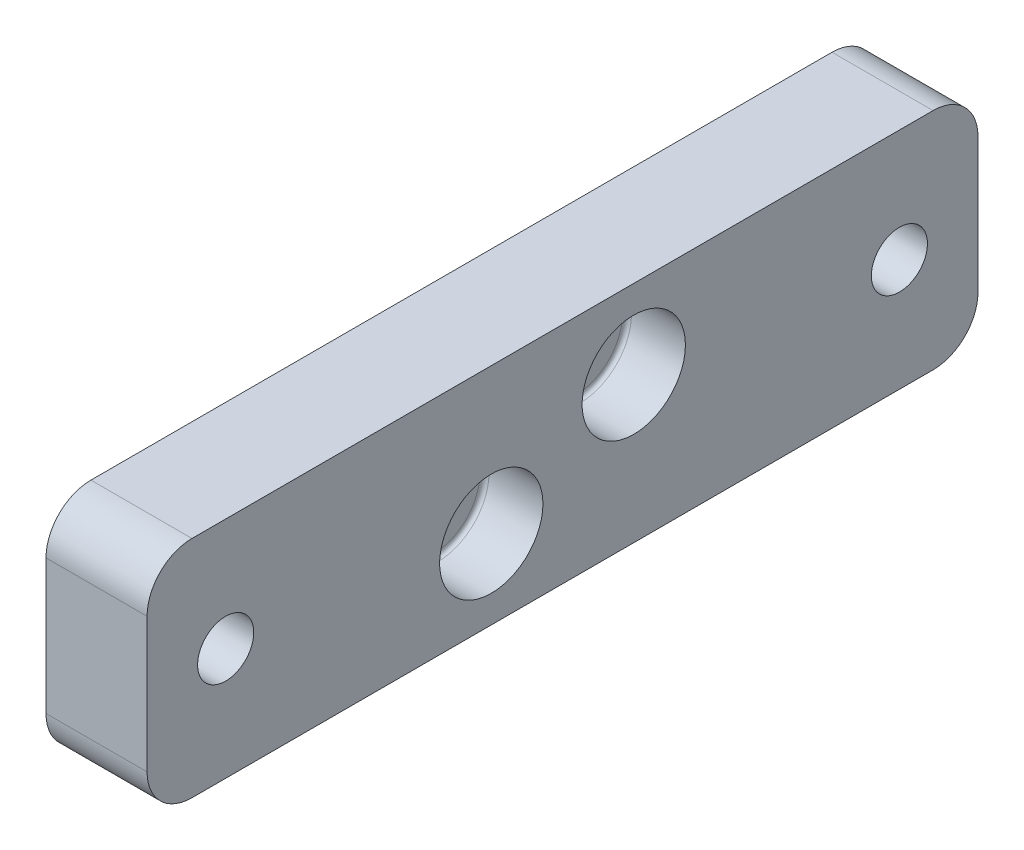
from build123d import *

# Parameters (mm, degrees)
SKETCH1_W           = 46.99
SKETCH1_H           = 12.7
SKETCH1_R           = 1.5875
SKETCH1_R_2         = 1.6129
BOSS_EXTRUDE1_DEPTH = 5.715
SKETCH2_R           = 2.921
CUT_EXTRUDE1_DEPTH  = 3.302
FILLET1_R           = 2.54
FILLET2_R           = 0.254


with BuildPart() as part:
    # Sketch1 → Boss-Extrude1 (new body)
    with BuildSketch(Plane(origin=(0, 0, 0), x_dir=(0, 0, -1), z_dir=(1, 0, 0))):
        Rectangle(SKETCH1_W, SKETCH1_H)
        with Locations((-19.05, 0)):
            Circle(SKETCH1_R, mode=Mode.SUBTRACT)
        with Locations(Location((19.05, 0, 0), (0, 0, 180))):
            Circle(SKETCH1_R, mode=Mode.SUBTRACT)
        with Locations((-4.028538113, -1.878538173)):
            Circle(SKETCH1_R_2, mode=Mode.SUBTRACT)
        with Locations((4.028538113, 1.878538173)):
            Circle(SKETCH1_R_2, mode=Mode.SUBTRACT)
    extrude(amount=BOSS_EXTRUDE1_DEPTH)

    # Sketch2 → Cut-Extrude1 (cut)
    with BuildSketch(Plane(origin=(5.715, 0, 0), x_dir=(0, 0, -1), z_dir=(1, 0, 0))):
        with Locations((-4.028538113, -1.878538173)):
            Circle(SKETCH2_R)
        with Locations((4.028538113, 1.878538173)):
            Circle(SKETCH2_R)
    extrude(amount=-CUT_EXTRUDE1_DEPTH, mode=Mode.SUBTRACT)

    # Fillet1
    fillet1_edges = [part.edges().sort_by_distance(p)[0] for p in [
        (2.8575, 6.35, 23.495),
        (2.8575, 6.35, -23.495),
        (2.8575, -6.35, -23.495),
        (2.8575, -6.35, 23.495),
    ]]
    fillet(fillet1_edges, radius=FILLET1_R)

    # Fillet2
    fillet2_edges = [part.edges().sort_by_distance(p)[0] for p in [
        (2.413, -1.878538173, 6.949538113),
        (2.413, 1.878538173, -1.107538113),
    ]]
    fillet(fillet2_edges, radius=FILLET2_R)


solid = part.part
